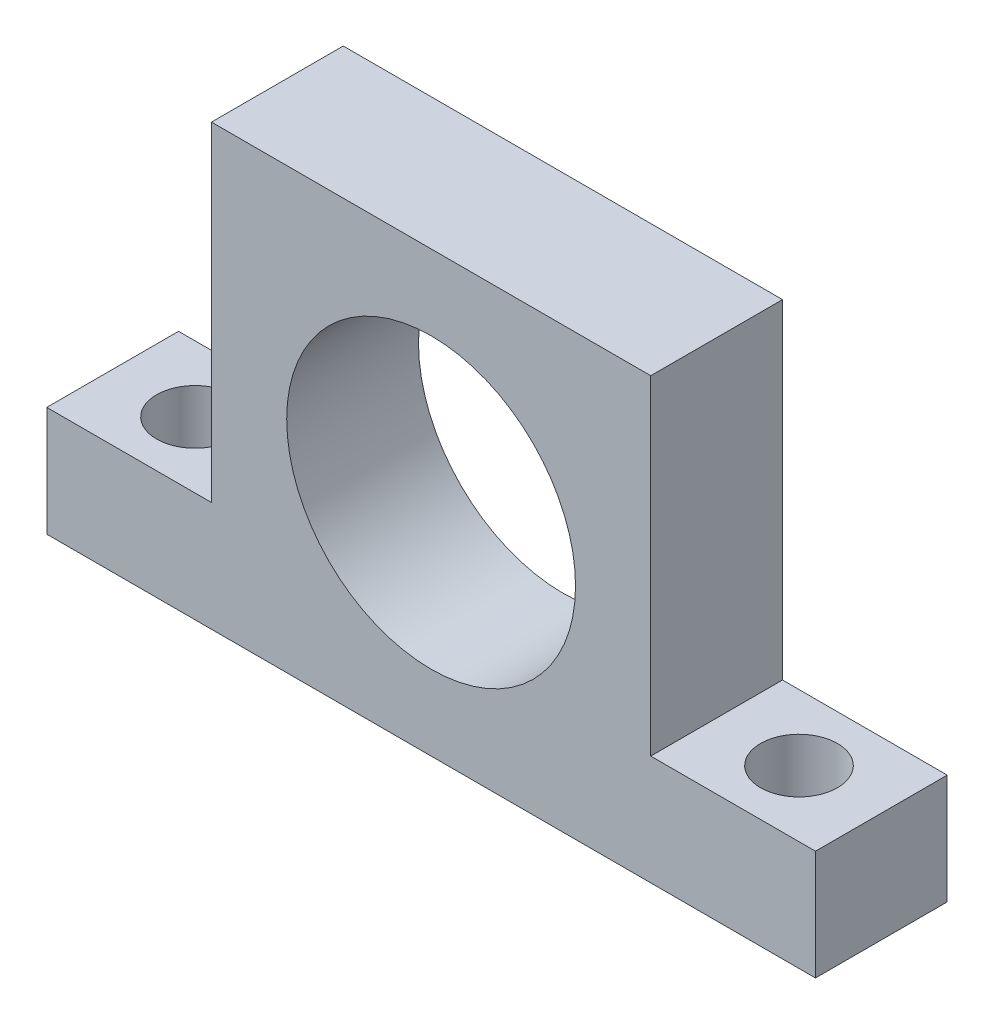
from build123d import *

# Parameters (mm, degrees)
SKETCH_1_R          = 13.15
EXTRUDE_1_DEPTH     = 12
SKETCH_2_R          = 3.5
CUT_EXTRUDE_2_DEPTH = 64.788713735
SKETCH_3_R          = 3.5
CUT_EXTRUDE_3_DEPTH = 64.788713735


with BuildPart() as part:
    # 草圖1 → 填料-伸長1 (new body)
    with BuildSketch(Plane.XY):
        Polygon((40, 0), (55, 0), (55, -10), (-15, -10), (-15, 0), (0, 0), (0, 30), (40, 30), align=None)
        with Locations((20, 10)):
            Circle(SKETCH_1_R, mode=Mode.SUBTRACT)
    extrude(amount=EXTRUDE_1_DEPTH)

    # 草圖2 → 除料-伸長2 (cut, through all)
    with BuildSketch(Plane(origin=(0, 0, 0), x_dir=(1, 0, 0), z_dir=(0, 1, 0))):
        with Locations(Location((47.5, -6, 0), (0, 0, 270))):
            Circle(SKETCH_2_R)
    extrude(amount=-CUT_EXTRUDE_2_DEPTH, mode=Mode.SUBTRACT)

    # 草圖3 → 除料-伸長3 (cut, through all)
    with BuildSketch(Plane(origin=(0, 0, 0), x_dir=(1, 0, 0), z_dir=(0, 1, 0))):
        with Locations(Location((-7.5, -6, 0), (0, 0, 270))):
            Circle(SKETCH_3_R)
    extrude(amount=-CUT_EXTRUDE_3_DEPTH, mode=Mode.SUBTRACT)


solid = part.part
